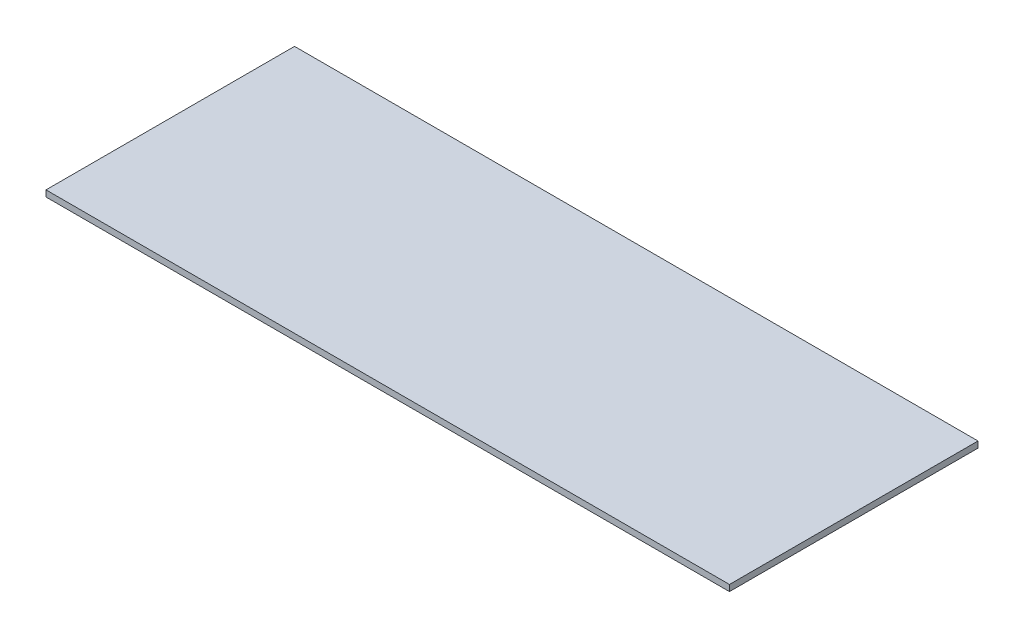
from build123d import *

# Parameters (mm, degrees)
SKETCH1_W           = 139.7
SKETCH1_H           = 50.8
BOSS_EXTRUDE1_DEPTH = 1.27


with BuildPart() as part:
    # Sketch1 → Boss-Extrude1 (new body)
    with BuildSketch(Plane(origin=(0, 0, 0), x_dir=(1, 0, 0), z_dir=(0, 1, 0))):
        with Locations((69.85, 25.4)):
            Rectangle(SKETCH1_W, SKETCH1_H)
    extrude(amount=BOSS_EXTRUDE1_DEPTH)


solid = part.part
